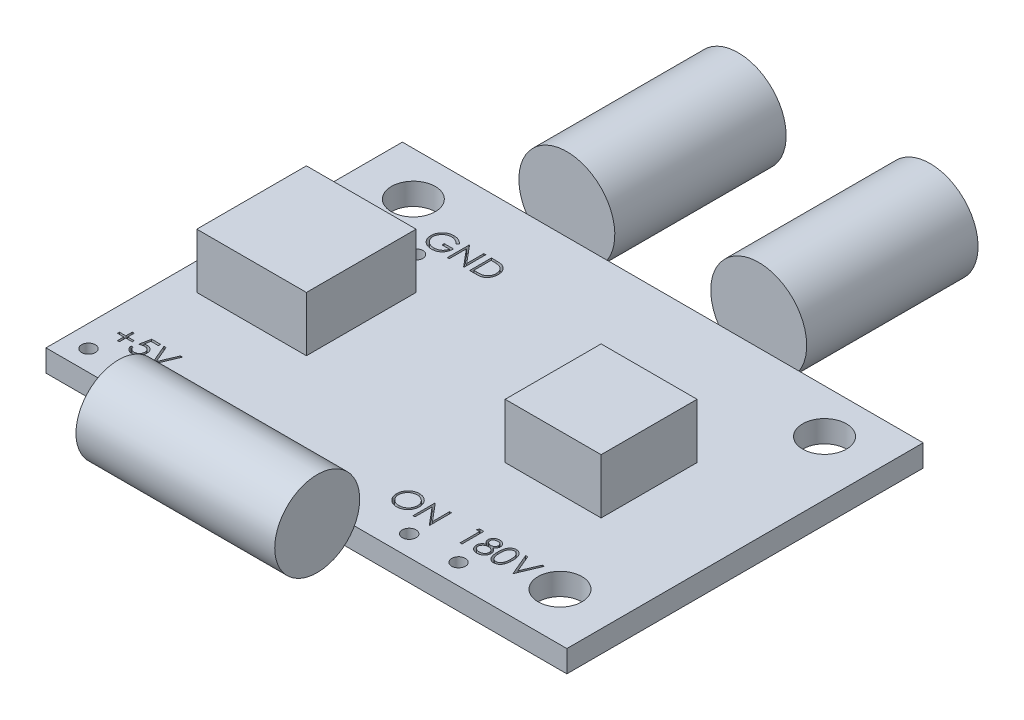
from build123d import *

# Parameters (mm, degrees)
SKETCH1_W           = 38
SKETCH1_H           = 26
SKETCH1_R           = 0.5
SKETCH1_R_2         = 1.6
BOSS_EXTRUDE1_DEPTH = 1.6
SKETCH2_W           = 8
SKETCH2_H           = 8
SKETCH2_W_2         = 7
SKETCH2_H_2         = 7
BOSS_EXTRUDE2_DEPTH = 4
BOSS_EXTRUDE3_START = -8
SKETCH3_R           = 3.1
BOSS_EXTRUDE3_DEPTH = 14.5
SKETCH4_R           = 3.5
BOSS_EXTRUDE4_DEPTH = 12.5
CUT_EXTRUDE1_DEPTH  = 0.5


with BuildPart() as part:
    # Sketch1 → Boss-Extrude1 (new body)
    with BuildSketch(Plane(origin=(0, 0, 0), x_dir=(1, 0, 0), z_dir=(0, 1, 0))):
        with Locations((19, 13)):
            Rectangle(SKETCH1_W, SKETCH1_H)
        with Locations(Location((28.6, 1.5, 0), (0, 0, 270))):
            Circle(SKETCH1_R, mode=Mode.SUBTRACT)
        with Locations(Location((25, 1.5, 0), (0, 0, 270))):
            Circle(SKETCH1_R, mode=Mode.SUBTRACT)
        with Locations(Location((1.6, 1.5, 0), (0, 0, 270))):
            Circle(SKETCH1_R, mode=Mode.SUBTRACT)
        with Locations(Location((7.6, 19.4, 0), (0, 0, 270))):
            Circle(SKETCH1_R, mode=Mode.SUBTRACT)
        with Locations(Location((4, 22.8, 0), (0, 0, 270))):
            Circle(SKETCH1_R_2, mode=Mode.SUBTRACT)
        with Locations(Location((34, 22.8, 0), (0, 0, 270))):
            Circle(SKETCH1_R_2, mode=Mode.SUBTRACT)
        with Locations(Location((34, 3.5, 0), (0, 0, 270))):
            Circle(SKETCH1_R_2, mode=Mode.SUBTRACT)
    extrude(amount=BOSS_EXTRUDE1_DEPTH)

    # Sketch2 → Boss-Extrude2 (add)
    with BuildSketch(Plane(origin=(0, 1.6, 0), x_dir=(1, 0, 0), z_dir=(0, 1, 0))):
        with Locations((6, 13)):
            Rectangle(SKETCH2_W, SKETCH2_H)
        with Locations((27.5, 13)):
            Rectangle(SKETCH2_W_2, SKETCH2_H_2)
    extrude(amount=BOSS_EXTRUDE2_DEPTH)

    # Sketch4 → Boss-Extrude4 (add)
    with BuildSketch(Plane(origin=(0, 0, -26), x_dir=(-1, 0, 0), z_dir=(0, 0, -1))):
        with Locations(Location((-26, 3.5, 0), (0, 0, 212.878349564))):
            Circle(SKETCH4_R)
        with Locations(Location((-12, 3.5, 0), (0, 0, 212.878349564))):
            Circle(SKETCH4_R)
    extrude(amount=BOSS_EXTRUDE4_DEPTH)

    # Sketch5 → Cut-Extrude1 (cut)
    # profile 1 of 12: a face of its own
    with BuildSketch(Plane(origin=(0, 1.6, 0), x_dir=(1, 0, 0), z_dir=(0, 1, 0))):
        with BuildLine():
            add(Edge.make_bspline(
                [(22.823721125, 4.41342604), (22.85311623, 4.412681512), (22.910850642, 4.411219198), (22.99570247, 4.400025461), (23.076708103, 4.380660052), (23.154527416, 4.354868628), (23.228229587, 4.320463246), (23.298369371, 4.278877483), (23.364779881, 4.22967566), (23.426566008, 4.173238118), (23.483106839, 4.111832051), (23.532920723, 4.046300999), (23.574668478, 3.977041185), (23.608952031, 3.904260737), (23.635848186, 3.828124252), (23.654407895, 3.748225829), (23.666263413, 3.665083152), (23.667649427, 3.608374538), (23.668352535, 3.57960693)],
                knots=[0, 0, 0, 0, 1.065120563, 2.091984664, 3.0946048, 4.079830382, 5.057816894, 6.036188127, 7.030412546, 8.04752943, 9.064399622, 10.05169764, 11.02544977, 11.989514704, 12.962713494, 13.945757189, 14.957906945, 16, 16, 16, 16], degree=3))
            add(Edge.make_bspline(
                [(23.668352535, 3.57960693), (23.66764953, 3.551051231), (23.666263825, 3.49476464), (23.654394416, 3.412149578), (23.635779391, 3.332733441), (23.609201798, 3.256648805), (23.575081671, 3.18381541), (23.533055932, 3.114424899), (23.483552597, 3.048454523), (23.427215919, 2.986626993), (23.365801875, 2.929931712), (23.299929575, 2.880529221), (23.231080462, 2.838018636), (23.158368559, 2.804098899), (23.082758185, 2.776988063), (23.003572631, 2.758503835), (22.921182944, 2.746580783), (22.864998596, 2.74521167), (22.836441477, 2.744515784)],
                knots=[0, 0, 0, 0, 1.043624062, 2.057103931, 3.04512605, 4.022047818, 4.998200453, 5.980619268, 6.982898556, 8.009068085, 9.034988726, 10.034168286, 11.015286542, 11.987931943, 12.962482838, 13.94673481, 14.956375938, 16, 16, 16, 16], degree=3))
            add(Edge.make_bspline(
                [(22.836441477, 2.744515784), (22.807674018, 2.745218542), (22.750965699, 2.746603864), (22.667718544, 2.758479001), (22.587763995, 2.777048807), (22.5113307, 2.803587015), (22.438376036, 2.837884831), (22.36875732, 2.879706103), (22.302753992, 2.929330056), (22.240913272, 2.985648467), (22.1843306, 3.046958421), (22.135000454, 3.112651101), (22.093169778, 3.181437683), (22.058987123, 3.25350906), (22.031925029, 3.328516821), (22.013462487, 3.406961309), (22.001517251, 3.488395299), (22.000140732, 3.543841185), (21.999442279, 3.571974718)],
                knots=[0, 0, 0, 0, 1.053102029, 2.075944431, 3.073151272, 4.055350789, 5.033113405, 6.020478099, 7.024410459, 8.052272461, 9.079885166, 10.07527673, 11.055994387, 12.023226415, 12.992069828, 13.970394897, 14.97016774, 16, 16, 16, 16], degree=3))
            add(Edge.make_bspline(
                [(21.999442279, 3.571974718), (21.999684774, 3.590858108), (22.000166706, 3.628386664), (22.005968652, 3.684115443), (22.014387709, 3.738947991), (22.026453577, 3.792728386), (22.042234083, 3.845324975), (22.060854109, 3.8971005), (22.083596111, 3.94753026), (22.109304833, 3.996853156), (22.137998582, 4.044300313), (22.169692225, 4.089149267), (22.203272553, 4.131776362), (22.24008595, 4.171076967), (22.278919123, 4.208194375), (22.32040203, 4.242558179), (22.364281548, 4.274478246), (22.410746485, 4.303243901), (22.458651916, 4.329260366), (22.508035312, 4.351585991), (22.558225971, 4.370747597), (22.609458972, 4.386278257), (22.661598265, 4.398539216), (22.714757646, 4.406888266), (22.768894765, 4.41270501), (22.805367041, 4.413184663), (22.823721125, 4.41342604)],
                knots=[0, 0, 0, 0, 1.037015668, 2.060948919, 3.074880161, 4.083647147, 5.086022904, 6.090072063, 7.104153813, 8.122640571, 9.144368836, 10.147691507, 11.138137339, 12.123020368, 13.103399296, 14.087645067, 15.080126199, 16.082011238, 17.087798457, 18.072939717, 19.057185487, 20.037253025, 21.01195951, 21.997135196, 22.992090687, 24, 24, 24, 24], degree=3))
        make_face()
        with BuildLine():
            add(Edge.make_bspline(
                [(22.830717319, 4.250605528), (22.81565211, 4.250421881), (22.785665717, 4.250056343), (22.741086659, 4.245241358), (22.697093889, 4.238378873), (22.653678321, 4.228590112), (22.611021612, 4.215253273), (22.568726148, 4.199904004), (22.52717762, 4.181207295), (22.486513191, 4.160083247), (22.447090997, 4.13670213), (22.409892378, 4.110861364), (22.374821036, 4.083166948), (22.34196284, 4.053554251), (22.311414273, 4.021872467), (22.282574069, 3.988601898), (22.256598223, 3.952791576), (22.232792265, 3.91541257), (22.211488995, 3.876513567), (22.192545423, 3.836504093), (22.177049605, 3.795057786), (22.164412027, 3.752624293), (22.153934613, 3.70927082), (22.147297083, 3.664668488), (22.142429191, 3.61904142), (22.142084547, 3.588206793), (22.141910227, 3.572610736)],
                knots=[0, 0, 0, 0, 1.008559885, 2.007477868, 2.99961109, 3.989939068, 4.984837346, 5.991145699, 7.001802488, 8.033829008, 9.059044045, 10.069351652, 11.065060232, 12.050310815, 13.029377138, 14.011219647, 14.996725999, 15.989392538, 16.977580475, 17.965360261, 18.951710183, 19.937753436, 20.929683414, 21.935841486, 22.955955122, 24, 24, 24, 24], degree=3))
            add(Edge.make_bspline(
                [(22.141910227, 3.572610736), (22.142488468, 3.549677157), (22.143626047, 3.504559713), (22.153585374, 3.438443448), (22.168926055, 3.374903404), (22.191539932, 3.314287252), (22.219820389, 3.256073952), (22.254757586, 3.200779919), (22.2961501, 3.148390208), (22.343168913, 3.099270568), (22.394568855, 3.054436936), (22.449148344, 3.015083533), (22.506322658, 2.981786741), (22.566240897, 2.954660869), (22.628583173, 2.933166238), (22.693751205, 2.918434858), (22.761310878, 2.908739563), (22.807362282, 2.907808491), (22.830717319, 2.907336297)],
                knots=[0, 0, 0, 0, 1.032063989, 2.030389145, 3.003944642, 3.970395727, 4.937377036, 5.913328081, 6.909231446, 7.93887556, 8.970685674, 9.976071282, 10.964166581, 11.944589148, 12.933237628, 13.927779006, 14.949070134, 16, 16, 16, 16], degree=3))
            add(Edge.make_bspline(
                [(22.830717319, 2.907336297), (22.8464152, 2.907551972), (22.877548813, 2.907979721), (22.923856425, 2.912288049), (22.969329778, 2.91919679), (23.01390509, 2.929143909), (23.057531773, 2.941593177), (23.100391916, 2.956383111), (23.142028997, 2.974834943), (23.182968281, 2.995222049), (23.222155148, 3.018463121), (23.259563693, 3.043426853), (23.294251012, 3.071080477), (23.327084627, 3.1002532), (23.357758614, 3.131533231), (23.386065546, 3.164879903), (23.411910106, 3.200503701), (23.435707024, 3.23782601), (23.456935647, 3.276831453), (23.475431881, 3.316985985), (23.491123691, 3.358190731), (23.503791263, 3.400505123), (23.513717883, 3.443848793), (23.520557704, 3.488279779), (23.525342174, 3.533709195), (23.525702798, 3.564435873), (23.525884586, 3.579924939)],
                knots=[0, 0, 0, 0, 1.047197238, 2.076906641, 3.100256066, 4.114471768, 5.12198147, 6.126382909, 7.136867548, 8.15857795, 9.17633901, 10.174870724, 11.156907918, 12.133735059, 13.104061851, 14.077631395, 15.04955518, 16.038496417, 17.029181396, 18.010275684, 18.986308667, 19.968651475, 20.955262928, 21.950658345, 22.966943676, 24, 24, 24, 24], degree=3))
            add(Edge.make_bspline(
                [(23.525884586, 3.579924939), (23.525702653, 3.595308042), (23.525341754, 3.625823262), (23.520559989, 3.670935848), (23.513710657, 3.715047126), (23.503839714, 3.757983922), (23.491116966, 3.799757182), (23.475429141, 3.840327671), (23.456930094, 3.879846531), (23.435699221, 3.918216087), (23.411834187, 3.955034629), (23.385756441, 3.990232866), (23.35701573, 4.023149788), (23.326433211, 4.054598024), (23.293244988, 4.083906853), (23.257601398, 4.111085996), (23.219935158, 4.136791374), (23.180053876, 4.159980468), (23.138895012, 4.181395495), (23.096661181, 4.199742914), (23.053830839, 4.215333126), (23.010512902, 4.228630463), (22.966342766, 4.238340534), (22.921618886, 4.245247542), (22.87640314, 4.250054668), (22.845994251, 4.250421325), (22.830717319, 4.250605528)],
                knots=[0, 0, 0, 0, 1.02996197, 2.043119294, 3.035359645, 4.018872909, 4.991431989, 5.957985074, 6.929999688, 7.912076566, 8.892894881, 9.867085534, 10.843653904, 11.817741046, 12.803660682, 13.806313499, 14.818574707, 15.856120519, 16.894564902, 17.924820532, 18.937903209, 19.946497019, 20.957711757, 21.963978472, 22.977135795, 24, 24, 24, 24], degree=3))
        make_face(mode=Mode.SUBTRACT)
    # profile 2 of 12: a face of its own
    with BuildSketch(Plane(origin=(0, 1.6, 0), x_dir=(1, 0, 0), z_dir=(0, 1, 0))):
        Polygon((23.993993561, 2.785220912), (23.993993561, 4.372720912), (24.023886389, 4.372720912), (25.072679458, 3.123264282), (25.072679458, 4.372720912), (25.215147407, 4.372720912), (25.215147407, 2.785220912), (25.182710508, 2.785220912), (24.136461509, 4.031815464), (24.136461509, 2.785220912), align=None)
    # profile 3 of 12: a face of its own
    with BuildSketch(Plane(origin=(0, 1.6, 0), x_dir=(1, 0, 0), z_dir=(0, 1, 0))):
        Polygon((27.274784117, 4.372720912), (27.568306253, 4.372720912), (27.568306253, 2.785220912), (27.425838304, 2.785220912), (27.425838304, 4.209900399), (27.181607535, 4.209900399), align=None)
    # profile 4 of 12: a face of its own
    with BuildSketch(Plane(origin=(0, 1.6, 0), x_dir=(1, 0, 0), z_dir=(0, 1, 0))):
        with BuildLine():
            add(Edge.make_bspline(
                [(28.930338004, 3.669603424), (28.943332166, 3.662827994), (28.968675122, 3.649613643), (29.00476907, 3.628336232), (29.037755053, 3.605911223), (29.068548272, 3.583397815), (29.096607721, 3.559933816), (29.121619651, 3.53542592), (29.144201893, 3.510485866), (29.163899041, 3.484691332), (29.181224035, 3.458110845), (29.196197396, 3.430674639), (29.208995913, 3.402442841), (29.219139103, 3.373107279), (29.227494702, 3.343098874), (29.233243994, 3.312030147), (29.236335953, 3.280105821), (29.236920522, 3.258530198), (29.237216509, 3.247605728)],
                knots=[0, 0, 0, 0, 1.272397273, 2.481599622, 3.635517121, 4.734568067, 5.792894095, 6.808321871, 7.773003508, 8.711915296, 9.623354172, 10.525449501, 11.423591555, 12.311487226, 13.218079475, 14.126165749, 15.051214107, 16, 16, 16, 16], degree=3))
            add(Edge.make_bspline(
                [(29.237216509, 3.247605728), (29.236866615, 3.232321399), (29.236174043, 3.202067978), (29.23014155, 3.157415634), (29.221109592, 3.114048862), (29.207919956, 3.071977168), (29.190814239, 3.031432702), (29.169733674, 2.992380758), (29.145870735, 2.954181286), (29.126706327, 2.930677486), (29.117009177, 2.918784614)],
                knots=[0, 0, 0, 0, 1.025265484, 2.029385089, 3.018602448, 3.995076438, 4.983346944, 5.966715145, 6.97116228, 8, 8, 8, 8], degree=3))
            add(Edge.make_bspline(
                [(29.117009177, 2.918784614), (29.104383348, 2.904908152), (29.07928771, 2.877326704), (29.036296882, 2.841516872), (28.989115528, 2.811422683), (28.937926213, 2.786897216), (28.88286577, 2.767808273), (28.823945932, 2.754091131), (28.761051834, 2.746234172), (28.717823996, 2.745098434), (28.695647499, 2.744515784)],
                knots=[0, 0, 0, 0, 0.954267603, 1.896743057, 2.838368354, 3.796610408, 4.779680527, 5.799409237, 6.871065594, 8, 8, 8, 8], degree=3))
            add(Edge.make_bspline(
                [(28.695647499, 2.744515784), (28.674323569, 2.745038515), (28.632829367, 2.746055697), (28.572432759, 2.752947457), (28.516134081, 2.765025096), (28.463605988, 2.78155533), (28.415165152, 2.803059255), (28.370949602, 2.829823783), (28.330321408, 2.860771616), (28.294513543, 2.896791573), (28.262723427, 2.935371393), (28.234797918, 2.975173016), (28.211586818, 3.016200075), (28.191934885, 3.05784082), (28.176890818, 3.100678897), (28.16647128, 3.144493903), (28.159853984, 3.189209307), (28.15897354, 3.219386164), (28.158530612, 3.234567367)],
                knots=[0, 0, 0, 0, 1.256902934, 2.445805442, 3.576955095, 4.645999104, 5.686449165, 6.692658513, 7.68621702, 8.689161843, 9.678783111, 10.630372946, 11.551080876, 12.453998257, 13.34127905, 14.221779781, 15.105423033, 16, 16, 16, 16], degree=3))
            add(Edge.make_bspline(
                [(28.158530612, 3.234567367), (28.158792722, 3.245706714), (28.159310745, 3.267721997), (28.162896158, 3.3002473), (28.168660353, 3.331904832), (28.176488749, 3.362811527), (28.187098251, 3.392742376), (28.199908075, 3.421839198), (28.214845068, 3.450134842), (28.232117596, 3.477784049), (28.252211729, 3.504399399), (28.274964527, 3.530432583), (28.300830739, 3.555479644), (28.329522606, 3.579846601), (28.360712236, 3.603965703), (28.395209759, 3.62653348), (28.432100659, 3.649147628), (28.458319539, 3.662667833), (28.471769294, 3.669603424)],
                knots=[0, 0, 0, 0, 0.941657376, 1.861047343, 2.762797495, 3.66048619, 4.553285746, 5.444104102, 6.34607688, 7.256116206, 8.197091036, 9.162375105, 10.176350973, 11.237807142, 12.343728897, 13.50695164, 14.721116704, 16, 16, 16, 16], degree=3))
            add(Edge.make_bspline(
                [(28.471769294, 3.669603424), (28.453358206, 3.679643123), (28.417709187, 3.69908279), (28.370506262, 3.734800091), (28.329961229, 3.773484207), (28.297188553, 3.815952007), (28.271392936, 3.860876839), (28.253695211, 3.907977625), (28.24172252, 3.956381005), (28.240536509, 3.989449173), (28.239940868, 4.00605675)],
                knots=[0, 0, 0, 0, 1.166880483, 2.259407225, 3.286803203, 4.280235371, 5.237608625, 6.161067461, 7.076446754, 8, 8, 8, 8], degree=3))
            add(Edge.make_bspline(
                [(28.239940868, 4.00605675), (28.24068265, 4.022973856), (28.24217376, 4.056980191), (28.254231195, 4.10760154), (28.273879939, 4.157320482), (28.30060482, 4.205896038), (28.333891165, 4.251684171), (28.373826562, 4.292750957), (28.419457343, 4.32872438), (28.470555733, 4.358921429), (28.525545026, 4.383497589), (28.583563943, 4.400451374), (28.643601603, 4.411534898), (28.684467354, 4.412789773), (28.705187763, 4.41342604)],
                knots=[0, 0, 0, 0, 0.888701115, 1.786444228, 2.72001202, 3.692817113, 4.693886446, 5.687152267, 6.695133018, 7.739871481, 8.800368666, 9.853104506, 10.91144658, 12, 12, 12, 12], degree=3))
            add(Edge.make_bspline(
                [(28.705187763, 4.41342604), (28.725373422, 4.412770021), (28.765177242, 4.411476424), (28.823685519, 4.400687376), (28.879667517, 4.382667201), (28.932930183, 4.35822096), (28.982519994, 4.328109741), (29.026336042, 4.291642201), (29.065040463, 4.250756569), (29.097055527, 4.204982321), (29.123436552, 4.156593419), (29.141806604, 4.105964632), (29.153577678, 4.054189881), (29.155062382, 4.019156929), (29.155806253, 4.001604626)],
                knots=[0, 0, 0, 0, 1.072916533, 2.115669174, 3.151510826, 4.193348718, 5.225979165, 6.227137561, 7.216255879, 8.211077061, 9.189680878, 10.138522389, 11.067357538, 12, 12, 12, 12], degree=3))
            add(Edge.make_bspline(
                [(29.155806253, 4.001604626), (29.155155577, 3.984379497), (29.153877687, 3.950550321), (29.143128072, 3.901235078), (29.125024533, 3.85505151), (29.100307537, 3.811475564), (29.068092406, 3.771297527), (29.028809159, 3.734006486), (28.982770988, 3.699296103), (28.948181229, 3.679708002), (28.930338004, 3.669603424)],
                knots=[0, 0, 0, 0, 0.975232327, 1.915300861, 2.843280834, 3.77672583, 4.742871857, 5.749627742, 6.839139064, 8, 8, 8, 8], degree=3))
        make_face()
        with BuildLine():
            add(Edge.make_bspline(
                [(28.697237543, 4.250605528), (28.686101999, 4.250310053), (28.664316005, 4.249731975), (28.632371572, 4.246711807), (28.60199482, 4.240836598), (28.572868368, 4.233017611), (28.545391549, 4.222454845), (28.519191198, 4.210029252), (28.494713222, 4.194922572), (28.471662131, 4.1779766), (28.450910887, 4.159338032), (28.432493823, 4.139918952), (28.417195714, 4.119337971), (28.404204925, 4.098107036), (28.394779022, 4.075596025), (28.387719499, 4.052495099), (28.382947296, 4.028512335), (28.382589705, 4.012121846), (28.382408817, 4.003830688)],
                knots=[0, 0, 0, 0, 1.203892937, 2.355340988, 3.463153438, 4.544400666, 5.610487187, 6.640501085, 7.674077295, 8.714426146, 9.728707835, 10.68524104, 11.601827946, 12.495867327, 13.368432065, 14.231010473, 15.105153427, 16, 16, 16, 16], degree=3))
            add(Edge.make_bspline(
                [(28.382408817, 4.003830688), (28.382720587, 3.995539171), (28.383336689, 3.979153943), (28.388101515, 3.954957782), (28.395203017, 3.931180825), (28.406383853, 3.908388448), (28.419794308, 3.885789996), (28.436345799, 3.863950266), (28.45607118, 3.842793252), (28.478308626, 3.822498905), (28.502534573, 3.803494823), (28.528199479, 3.786996987), (28.554981235, 3.773192945), (28.582604673, 3.76170425), (28.611351326, 3.752773457), (28.641045048, 3.746437678), (28.671690829, 3.742499773), (28.692455593, 3.742029409), (28.702961701, 3.741791425)],
                knots=[0, 0, 0, 0, 0.873023192, 1.725219244, 2.590779336, 3.480155217, 4.391973325, 5.357036234, 6.360879153, 7.436073238, 8.526419356, 9.601555421, 10.645666583, 11.697338044, 12.750135903, 13.812665442, 14.89329948, 16, 16, 16, 16], degree=3))
            add(Edge.make_bspline(
                [(28.702961701, 3.741791425), (28.716455499, 3.742187333), (28.743309815, 3.742975238), (28.782897226, 3.750300949), (28.821388497, 3.761824347), (28.858372215, 3.777590474), (28.89289108, 3.797378825), (28.923661397, 3.82107023), (28.950420702, 3.848117645), (28.972890907, 3.878100003), (28.990312516, 3.910009473), (29.003875122, 3.942031749), (29.01179503, 3.974508475), (29.012828069, 3.99626492), (29.013338304, 4.007010776)],
                knots=[0, 0, 0, 0, 1.076279235, 2.141928126, 3.20205304, 4.278698113, 5.344010996, 6.36967002, 7.368914609, 8.37248503, 9.349703398, 10.264243087, 11.142681841, 12, 12, 12, 12], degree=3))
            add(Edge.make_bspline(
                [(29.013338304, 4.007010776), (29.013097051, 4.014552778), (29.012618197, 4.029522571), (29.0086721, 4.051628901), (29.002151633, 4.073232319), (28.993323736, 4.094511292), (28.981707865, 4.115167267), (28.967935537, 4.135524953), (28.951205781, 4.155126389), (28.932429541, 4.17442837), (28.911136445, 4.192291838), (28.887367528, 4.208001153), (28.861244648, 4.221341757), (28.832767189, 4.232177014), (28.802040027, 4.240315151), (28.769204687, 4.246409495), (28.733987385, 4.249844442), (28.709753176, 4.25034633), (28.697237543, 4.250605528)],
                knots=[0, 0, 0, 0, 0.814439003, 1.616544685, 2.417341072, 3.248991801, 4.09997495, 4.973547432, 5.9003056, 6.880240646, 7.880314356, 8.896779544, 9.951930927, 11.043077905, 12.18215768, 13.381699519, 14.647792085, 16, 16, 16, 16], degree=3))
        make_face(mode=Mode.SUBTRACT)
        with BuildLine():
            add(Edge.make_bspline(
                [(28.706459798, 3.578970912), (28.692342031, 3.578719796), (28.664646417, 3.578227168), (28.624071311, 3.572743716), (28.585130768, 3.565110384), (28.547956082, 3.553530326), (28.512562953, 3.538473346), (28.478759779, 3.52036018), (28.446805159, 3.498949139), (28.417140351, 3.474512246), (28.390051555, 3.448178136), (28.366285184, 3.420300668), (28.34610238, 3.391397948), (28.329849441, 3.361102901), (28.31650912, 3.33005702), (28.307748897, 3.297487147), (28.302132906, 3.26401942), (28.301378784, 3.241268233), (28.30099856, 3.229797234)],
                knots=[0, 0, 0, 0, 1.140299081, 2.23698856, 3.303958914, 4.344563908, 5.37730929, 6.408454204, 7.439741482, 8.480804886, 9.510774543, 10.48932336, 11.43758569, 12.353841022, 13.263987381, 14.161954604, 15.073269652, 16, 16, 16, 16], degree=3))
            add(Edge.make_bspline(
                [(28.30099856, 3.229797234), (28.301616896, 3.215541073), (28.302843658, 3.187257183), (28.312575777, 3.145454647), (28.328194752, 3.104986526), (28.349977618, 3.066182604), (28.376950409, 3.029919521), (28.410118486, 2.998310683), (28.44742058, 2.97022487), (28.490118821, 2.94750977), (28.536758875, 2.929369247), (28.587328338, 2.91687065), (28.641101462, 2.908596849), (28.678230634, 2.907763103), (28.697237543, 2.907336297)],
                knots=[0, 0, 0, 0, 0.898778495, 1.783155532, 2.693654817, 3.627872908, 4.583023416, 5.533784346, 6.509005473, 7.520592997, 8.575161974, 9.658835044, 10.801527049, 12, 12, 12, 12], degree=3))
            add(Edge.make_bspline(
                [(28.697237543, 2.907336297), (28.712092174, 2.907621506), (28.741033759, 2.908177186), (28.783254886, 2.913082241), (28.823098663, 2.920860821), (28.860487825, 2.9321745), (28.895840924, 2.94598574), (28.928558553, 2.963753077), (28.959482385, 2.983960738), (28.987088612, 3.007935687), (29.012231531, 3.033553172), (29.034154132, 3.060672228), (29.053184878, 3.088555818), (29.068121419, 3.117834073), (29.080062255, 3.147945281), (29.088645439, 3.179167102), (29.093941437, 3.211595297), (29.094477057, 3.23359309), (29.09474856, 3.244743649)],
                knots=[0, 0, 0, 0, 1.224942928, 2.386581632, 3.501229538, 4.569074225, 5.605009692, 6.626002462, 7.634866581, 8.645888296, 9.63523824, 10.59253846, 11.518950513, 12.414518923, 13.29783783, 14.186679152, 15.080837789, 16, 16, 16, 16], degree=3))
            add(Edge.make_bspline(
                [(29.09474856, 3.244743649), (29.094337693, 3.255573728), (29.093527535, 3.276928753), (29.088385536, 3.308572856), (29.079352263, 3.339144847), (29.066957337, 3.369012528), (29.050455972, 3.397570724), (29.031022763, 3.425563416), (29.007575788, 3.45221366), (28.981081503, 3.477728457), (28.952207617, 3.501321309), (28.921515734, 3.522192144), (28.889242103, 3.539768997), (28.855455018, 3.554063979), (28.820229501, 3.565306867), (28.783591462, 3.573160907), (28.745498005, 3.578104656), (28.719619546, 3.578678898), (28.706459798, 3.578970912)],
                knots=[0, 0, 0, 0, 0.917430815, 1.809013306, 2.70690318, 3.612392954, 4.541220862, 5.495268465, 6.494511384, 7.542276156, 8.608045339, 9.649016899, 10.681629292, 11.715607085, 12.752076957, 13.808767841, 14.885711793, 16, 16, 16, 16], degree=3))
        make_face(mode=Mode.SUBTRACT)
    # profile 5 of 12: a face of its own
    with BuildSketch(Plane(origin=(0, 1.6, 0), x_dir=(1, 0, 0), z_dir=(0, 1, 0))):
        with BuildLine():
            add(Edge.make_bspline(
                [(29.379684458, 3.578334895), (29.379833238, 3.603779067), (29.380122244, 3.653204738), (29.383337349, 3.725224915), (29.388678308, 3.792789046), (29.39599776, 3.855900366), (29.404904986, 3.914575166), (29.416795582, 3.968656645), (29.430317817, 4.01839511), (29.44598982, 4.063952753), (29.463673567, 4.105943354), (29.482920535, 4.145143356), (29.504494567, 4.181493447), (29.527162667, 4.215573802), (29.551842428, 4.246826549), (29.577831522, 4.275693042), (29.606144302, 4.301506133), (29.635818309, 4.325022134), (29.667122205, 4.345636716), (29.6991637, 4.363794422), (29.732163337, 4.379306505), (29.766211213, 4.391503238), (29.801001302, 4.401577444), (29.836655222, 4.408466717), (29.87323184, 4.412801457), (29.897920384, 4.413215871), (29.910441169, 4.41342604)],
                knots=[0, 0, 0, 0, 1.646270934, 3.197905019, 4.663502075, 6.030701355, 7.308322542, 8.50163776, 9.611534131, 10.641858119, 11.616356847, 12.558055219, 13.465016945, 14.349605745, 15.204443733, 16.039544428, 16.859896111, 17.680448484, 18.487036065, 19.28249412, 20.06191084, 20.843045899, 21.620316918, 22.403196591, 23.190181807, 24, 24, 24, 24], degree=3))
            add(Edge.make_bspline(
                [(29.910441169, 4.41342604), (29.923066546, 4.413204781), (29.94817445, 4.412764767), (29.985294906, 4.408535693), (30.021557798, 4.401518434), (30.056808525, 4.391575706), (30.091336644, 4.379240524), (30.124872086, 4.363779581), (30.157623155, 4.345782381), (30.189069393, 4.324635122), (30.219556022, 4.301057447), (30.248334205, 4.274404379), (30.275406562, 4.244945042), (30.301112861, 4.212994626), (30.324723792, 4.177940319), (30.347208885, 4.140391812), (30.367334773, 4.099692456), (30.386718, 4.056521315), (30.403448884, 4.00968387), (30.418537502, 3.959444139), (30.430729034, 3.905208704), (30.440884168, 3.847262122), (30.448751318, 3.785391585), (30.454481123, 3.71972972), (30.457507844, 3.650233329), (30.458077848, 3.602718161), (30.458370355, 3.578334895)],
                knots=[0, 0, 0, 0, 0.810914788, 1.612654377, 2.396697861, 3.181598691, 3.963628158, 4.749916497, 5.551656086, 6.361998678, 7.18212741, 8.025565596, 8.878627764, 9.750805457, 10.657531673, 11.591944965, 12.560506719, 13.57287815, 14.630710178, 15.753379473, 16.941251878, 18.199788006, 19.531962791, 20.947069417, 22.433333509, 24, 24, 24, 24], degree=3))
            add(Edge.make_bspline(
                [(30.458370355, 3.578334895), (30.458074815, 3.554057979), (30.457498967, 3.5067554), (30.454515054, 3.437571707), (30.448637389, 3.372258309), (30.441285001, 3.310658564), (30.431101886, 3.253028858), (30.418580971, 3.199169769), (30.404678861, 3.148848708), (30.387518079, 3.102477918), (30.368735364, 3.05941053), (30.348299614, 3.019193644), (30.3264058, 2.98147179), (30.302553048, 2.946546905), (30.277128821, 2.914171586), (30.249588967, 2.884917307), (30.220709809, 2.858079181), (30.190133463, 2.834197907), (30.158196795, 2.813295156), (30.125558214, 2.794601731), (30.091638608, 2.77952833), (30.057206662, 2.766585651), (30.021769867, 2.756697589), (29.985372397, 2.749860518), (29.94819939, 2.74506543), (29.923070823, 2.744699634), (29.910441169, 2.744515784)],
                knots=[0, 0, 0, 0, 1.561518951, 3.042555995, 4.452378317, 5.7783523, 7.031515105, 8.214008947, 9.334062868, 10.386615937, 11.391082383, 12.354592575, 13.286541444, 14.194233754, 15.072674879, 15.931287219, 16.775624067, 17.606195743, 18.42308326, 19.229000347, 20.022332153, 20.807536673, 21.593273796, 22.3848459, 23.188221202, 24, 24, 24, 24], degree=3))
            add(Edge.make_bspline(
                [(29.910441169, 2.744515784), (29.897920731, 2.74472731), (29.873232872, 2.745144397), (29.836651237, 2.749459553), (29.801144557, 2.756397157), (29.766537622, 2.766111116), (29.732652881, 2.778001417), (29.699952066, 2.793492552), (29.66807158, 2.811333362), (29.637096482, 2.831651285), (29.607608823, 2.854929334), (29.57944267, 2.880675994), (29.553305608, 2.909533756), (29.528978714, 2.941046956), (29.505858324, 2.974925677), (29.484590644, 3.011632475), (29.464918864, 3.051021802), (29.446937709, 3.09334814), (29.43099528, 3.139229125), (29.416912927, 3.189189645), (29.405794005, 3.243670666), (29.396276736, 3.302234614), (29.38860032, 3.365133147), (29.383359608, 3.432400411), (29.380120511, 3.503994488), (29.379832461, 3.553102564), (29.379684458, 3.578334895)],
                knots=[0, 0, 0, 0, 0.810891512, 1.598919785, 2.382837074, 3.152667961, 3.926044502, 4.706494248, 5.493654104, 6.291793342, 7.103789334, 7.925228297, 8.761435821, 9.622817696, 10.50288917, 11.416980706, 12.369136599, 13.353924996, 14.394355917, 15.514179734, 16.714354668, 17.994756427, 19.357759367, 20.818452758, 22.365282078, 24, 24, 24, 24], degree=3))
        make_face()
        with BuildLine():
            add(Edge.make_bspline(
                [(29.522152407, 3.578970912), (29.522206584, 3.557767038), (29.522311733, 3.516614482), (29.525058652, 3.456814146), (29.528800722, 3.401038318), (29.53362731, 3.349216178), (29.540795076, 3.301523137), (29.548826369, 3.257631174), (29.558599967, 3.21777257), (29.570163779, 3.181673813), (29.583335083, 3.148722271), (29.597715957, 3.118060291), (29.613164928, 3.089325663), (29.630454686, 3.062776491), (29.649284732, 3.038326195), (29.669229746, 3.015542017), (29.691034097, 2.995223386), (29.721198294, 2.97085442), (29.761020267, 2.945672527), (29.811194545, 2.923744122), (29.862751306, 2.909963508), (29.897744909, 2.908211019), (29.915211301, 2.907336297)],
                knots=[0, 0, 0, 0, 1.459021318, 2.831673884, 4.118529203, 5.306027144, 6.411944654, 7.436330062, 8.375795394, 9.233974572, 10.042671642, 10.816086306, 11.563610507, 12.285937304, 12.993564865, 13.685989202, 14.367179055, 15.041617293, 16.353048772, 17.594441528, 18.799311195, 20, 20, 20, 20], degree=3))
            add(Edge.make_bspline(
                [(29.915211301, 2.907336297), (29.932790673, 2.908061005), (29.967913124, 2.909508924), (30.019227381, 2.923478351), (30.069043253, 2.944555607), (30.108083026, 2.969478225), (30.137784037, 2.99321286), (30.159064243, 3.01344879), (30.178595958, 3.036107344), (30.197120756, 3.060554525), (30.214111123, 3.087257401), (30.229561189, 3.11608757), (30.243659707, 3.14712509), (30.251692024, 3.168792078), (30.255798741, 3.179869851)],
                knots=[0, 0, 0, 0, 1.353760809, 2.704726607, 4.075137775, 5.516104923, 6.260822281, 7.007110065, 7.778089737, 8.566572457, 9.372053459, 10.217411131, 11.088608312, 12, 12, 12, 12], degree=3))
            add(Edge.make_bspline(
                [(30.255798741, 3.179869851), (30.260584721, 3.194034768), (30.270302314, 3.222795625), (30.282826226, 3.267410568), (30.292689318, 3.314220393), (30.301562701, 3.362945356), (30.307619266, 3.413944792), (30.312494167, 3.467060902), (30.315365586, 3.522333734), (30.315721526, 3.559887177), (30.315902407, 3.578970912)],
                knots=[0, 0, 0, 0, 0.884706709, 1.796334032, 2.740027952, 3.714592787, 4.726048262, 5.777819803, 6.87074269, 8, 8, 8, 8], degree=3))
            add(Edge.make_bspline(
                [(30.315902407, 3.578970912), (30.315652856, 3.598051561), (30.315164683, 3.63537739), (30.313298696, 3.690040993), (30.308480146, 3.741960299), (30.303128403, 3.791358977), (30.29523752, 3.837963579), (30.286729515, 3.882164253), (30.275298965, 3.923413411), (30.263088924, 3.962356864), (30.249114209, 3.998552161), (30.233731001, 4.032168057), (30.217301846, 4.063366843), (30.19945733, 4.09206292), (30.180409288, 4.118384823), (30.159654971, 4.1418048), (30.138017631, 4.163048711), (30.107711264, 4.187297804), (30.068035426, 4.212022752), (30.01866615, 4.234776507), (29.967289822, 4.247843126), (29.932558291, 4.249685391), (29.915211301, 4.250605528)],
                knots=[0, 0, 0, 0, 1.31362396, 2.569729283, 3.763502607, 4.902122613, 5.988968491, 7.01645872, 7.998833611, 8.933434873, 9.825090667, 10.667526885, 11.477055099, 12.250526234, 12.991942729, 13.710640831, 14.402115721, 15.076753259, 16.378508321, 17.609869233, 18.806226677, 20, 20, 20, 20], degree=3))
            add(Edge.make_bspline(
                [(29.915211301, 4.250605528), (29.897653282, 4.249684122), (29.862505259, 4.247839631), (29.810594936, 4.234825191), (29.760836177, 4.212140738), (29.721265256, 4.187215912), (29.690937753, 4.163476749), (29.669582389, 4.142890751), (29.649558946, 4.120372628), (29.631113239, 4.095697474), (29.613837029, 4.069179254), (29.597970641, 4.04060935), (29.583675281, 4.009842981), (29.570483366, 3.976906241), (29.55888428, 3.940810598), (29.549316661, 3.90100109), (29.54047789, 3.857248732), (29.534220751, 3.809297384), (29.528658261, 3.757462264), (29.525083507, 3.701547195), (29.522302544, 3.641646565), (29.522203455, 3.600281233), (29.522152407, 3.578970912)],
                knots=[0, 0, 0, 0, 1.207732386, 2.417664972, 3.655092373, 4.956220595, 5.625982001, 6.301752483, 6.994047911, 7.697131622, 8.419323945, 9.170223765, 9.943494443, 10.752040957, 11.610060368, 12.549350801, 13.567764191, 14.679664412, 15.874934091, 17.154273443, 18.533957287, 20, 20, 20, 20], degree=3))
        make_face(mode=Mode.SUBTRACT)
    # profile 6 of 12: a face of its own
    with BuildSketch(Plane(origin=(0, 1.6, 0), x_dir=(1, 0, 0), z_dir=(0, 1, 0))):
        Polygon((30.621190868, 4.372720912), (30.773835099, 4.372720912), (31.303001766, 3.121674238), (31.832168432, 4.372720912), (31.984812663, 4.372720912), (31.313178048, 2.785220912), (31.292825484, 2.785220912), align=None)
    # profile 7 of 12: a face of its own
    with BuildSketch(Plane(origin=(0, 1.6, 0), x_dir=(1, 0, 0), z_dir=(0, 1, 0))):
        with BuildLine():
            Line((8.51148536, 21.656377846), (8.389369976, 21.540622638))
            add(Edge.make_bspline(
                [(8.389369976, 21.540622638), (8.36727248, 21.561410208), (8.323604416, 21.602489657), (8.252411735, 21.655789287), (8.178133229, 21.701448553), (8.10115649, 21.738598882), (8.023387788, 21.768241027), (7.945859379, 21.789344862), (7.869366507, 21.802803477), (7.818490662, 21.804412916), (7.793421458, 21.805205971)],
                knots=[0, 0, 0, 0, 1.08915593, 2.152340314, 3.188132944, 4.216796309, 5.218260357, 6.173443236, 7.099959455, 8, 8, 8, 8], degree=3))
            add(Edge.make_bspline(
                [(7.793421458, 21.805205971), (7.778038719, 21.805018372), (7.747313137, 21.804643659), (7.701673898, 21.799861104), (7.656513317, 21.792982755), (7.611916643, 21.783030546), (7.567797167, 21.770417151), (7.524308333, 21.754639459), (7.481369019, 21.736244759), (7.439383689, 21.71498928), (7.398679961, 21.691639492), (7.360236682, 21.665763904), (7.323808819, 21.638191846), (7.290081054, 21.608233009), (7.258859381, 21.576158766), (7.229400655, 21.542565767), (7.202740953, 21.506536221), (7.178660317, 21.468733026), (7.15717844, 21.429820141), (7.138215229, 21.390172106), (7.122296193, 21.349920429), (7.109700762, 21.309014601), (7.099309144, 21.267771083), (7.091998657, 21.2259043), (7.08787718, 21.183369421), (7.087164265, 21.154886379), (7.086805873, 21.14056755)],
                knots=[0, 0, 0, 0, 1.02818874, 2.053710826, 3.065248034, 4.081641283, 5.106893873, 6.131558223, 7.173050175, 8.228653731, 9.27666206, 10.308777013, 11.325269123, 12.329503258, 13.32196095, 14.316845687, 15.314881793, 16.315733098, 17.311955233, 18.285320748, 19.252783886, 20.203351036, 21.145449891, 22.095197417, 23.042428769, 24, 24, 24, 24], degree=3))
            add(Edge.make_bspline(
                [(7.086805873, 21.14056755), (7.087148645, 21.125930429), (7.087833254, 21.096696157), (7.092214899, 21.053065274), (7.100346636, 21.010082395), (7.111217704, 20.967606278), (7.124816146, 20.925564176), (7.141767319, 20.884138359), (7.161844931, 20.84333036), (7.185084367, 20.80350787), (7.210568824, 20.76471707), (7.239118007, 20.728177572), (7.269444057, 20.693402806), (7.30265179, 20.66116487), (7.337676368, 20.63060146), (7.375564222, 20.602554634), (7.415570338, 20.576484154), (7.457755752, 20.55271859), (7.501662728, 20.531487575), (7.546682756, 20.512608165), (7.592959658, 20.497060037), (7.640250235, 20.484388112), (7.688498112, 20.474001191), (7.737948194, 20.467318959), (7.788236886, 20.462469903), (7.822136194, 20.46211536), (7.839214727, 20.461936741)],
                knots=[0, 0, 0, 0, 0.93586088, 1.869166235, 2.799637598, 3.729985548, 4.670839027, 5.622275134, 6.589130586, 7.576015415, 8.568469353, 9.55398029, 10.53834874, 11.515998671, 12.510579167, 13.508179873, 14.527009472, 15.561807829, 16.601455013, 17.643573243, 18.680854198, 19.719860599, 20.772568776, 21.833555941, 22.908541556, 24, 24, 24, 24], degree=3))
            add(Edge.make_bspline(
                [(7.839214727, 20.461936741), (7.859797049, 20.462366988), (7.900213782, 20.463211848), (7.95962549, 20.469788765), (8.016686168, 20.480060703), (8.071235482, 20.495103807), (8.123336788, 20.514291545), (8.173181086, 20.537421595), (8.220375946, 20.565381126), (8.265063242, 20.596937844), (8.306228108, 20.632096357), (8.3433548, 20.670035092), (8.375851147, 20.710569894), (8.404201493, 20.753462019), (8.427655061, 20.799066497), (8.446905901, 20.847159837), (8.461662072, 20.897763673), (8.467719507, 20.932730235), (8.470780232, 20.950398279)],
                knots=[0, 0, 0, 0, 1.13008108, 2.219097802, 3.278683437, 4.311054135, 5.322181354, 6.324827112, 7.324222904, 8.330512327, 9.32562643, 10.293043162, 11.24128371, 12.174520618, 13.111833804, 14.052305215, 15.015860969, 16, 16, 16, 16], degree=3))
            Line((8.470780232, 20.950398279), (7.941613565, 20.950398279))
            Line((7.941613565, 20.950398279), (7.941613565, 21.113218792))
            Line((7.941613565, 21.113218792), (8.613248181, 21.113218792))
            add(Edge.make_bspline(
                [(8.613248181, 21.113218792), (8.612474457, 21.082871467), (8.610960139, 21.023476269), (8.600337988, 20.936857611), (8.583185498, 20.855046164), (8.559753857, 20.777955771), (8.529421141, 20.705695677), (8.492512887, 20.638192516), (8.448438389, 20.575882379), (8.398767581, 20.518256581), (8.343023672, 20.466853688), (8.282712905, 20.421675281), (8.217735637, 20.383619451), (8.148153332, 20.352658365), (8.074193778, 20.328494803), (7.995685834, 20.311362695), (7.912735965, 20.30109839), (7.85588683, 20.299786943), (7.826812384, 20.299116228)],
                knots=[0, 0, 0, 0, 1.140356446, 2.231883559, 3.274166699, 4.278491846, 5.25512956, 6.21435461, 7.1637429, 8.11826594, 9.068280886, 10.0076534, 10.945064095, 11.891975133, 12.864533718, 13.863980011, 14.907571808, 16, 16, 16, 16], degree=3))
            add(Edge.make_bspline(
                [(7.826812384, 20.299116228), (7.808891715, 20.299374365), (7.773546381, 20.299883495), (7.721344424, 20.303501791), (7.670581789, 20.30907191), (7.621265871, 20.317483448), (7.573215266, 20.327786166), (7.526669954, 20.340979071), (7.481452628, 20.356250231), (7.437493399, 20.373620054), (7.395191265, 20.39374577), (7.354357809, 20.416111214), (7.314767317, 20.440601059), (7.276689467, 20.467638836), (7.23992586, 20.497022309), (7.204713548, 20.528810372), (7.170855403, 20.562905844), (7.149646193, 20.587117038), (7.138959319, 20.599316548)],
                knots=[0, 0, 0, 0, 1.107784379, 2.184907829, 3.233506516, 4.263428166, 5.276301166, 6.270063455, 7.25232949, 8.225834625, 9.190232166, 10.146266622, 11.1027726, 12.066435141, 13.031522626, 14.010570082, 14.99756817, 16, 16, 16, 16], degree=3))
            add(Edge.make_bspline(
                [(7.138959319, 20.599316548), (7.123453557, 20.618670737), (7.092699412, 20.657057856), (7.053112534, 20.718562116), (7.019366184, 20.782244389), (6.991985064, 20.848281952), (6.970604575, 20.916613038), (6.955271025, 20.987150331), (6.946287004, 21.059984663), (6.944992721, 21.109272123), (6.944337924, 21.134207374)],
                knots=[0, 0, 0, 0, 1.023165419, 2.029347347, 3.013907458, 3.994755782, 4.975994455, 5.96558838, 6.970761222, 8, 8, 8, 8], degree=3))
            add(Edge.make_bspline(
                [(6.944337924, 21.134207374), (6.944579332, 21.15287921), (6.94505908, 21.189985574), (6.950876368, 21.245075139), (6.959222725, 21.299186524), (6.971490497, 21.352275498), (6.986955588, 21.404377516), (7.006256634, 21.455516771), (7.028728783, 21.505723442), (7.054847919, 21.554651946), (7.083914798, 21.601653019), (7.115460791, 21.646537451), (7.149933853, 21.688487848), (7.186771019, 21.728035489), (7.226411797, 21.764683537), (7.268484821, 21.798771295), (7.313022516, 21.830344486), (7.360164997, 21.858905804), (7.409208626, 21.884561446), (7.460035841, 21.907053696), (7.512631127, 21.925642557), (7.566600447, 21.94141495), (7.622352313, 21.953078603), (7.679482146, 21.961537141), (7.738287733, 21.967324984), (7.778036932, 21.967790464), (7.79819159, 21.968026484)],
                knots=[0, 0, 0, 0, 1.008945113, 2.00506715, 2.99143336, 3.967273523, 4.948097931, 5.927297278, 6.919902385, 7.919676788, 8.923139349, 9.905703106, 10.883022732, 11.856032218, 12.825136022, 13.798837087, 14.781400844, 15.773989409, 16.776158564, 17.77167057, 18.775803737, 19.789618931, 20.80898985, 21.851988756, 22.910860228, 24, 24, 24, 24], degree=3))
            add(Edge.make_bspline(
                [(7.79819159, 21.968026484), (7.814628222, 21.967763643), (7.847220132, 21.967242461), (7.895718589, 21.963629924), (7.943467421, 21.957904092), (7.990537426, 21.950090514), (8.036768314, 21.939448054), (8.082291784, 21.926712547), (8.127173827, 21.91188447), (8.171273783, 21.894200243), (8.214888175, 21.874128063), (8.25825951, 21.851534118), (8.301239597, 21.826032063), (8.34390297, 21.797546173), (8.386518663, 21.766565694), (8.428412626, 21.732204564), (8.470596104, 21.695817814), (8.497720498, 21.669654823), (8.51148536, 21.656377846)],
                knots=[0, 0, 0, 0, 0.985871117, 1.954866573, 2.915460327, 3.869826059, 4.81536089, 5.759505086, 6.70452669, 7.649098992, 8.607881297, 9.583363685, 10.581137262, 11.603961102, 12.659522466, 13.73993555, 14.853081303, 16, 16, 16, 16], degree=3))
        make_face()
    # profile 8 of 12: a face of its own
    with BuildSketch(Plane(origin=(0, 1.6, 0), x_dir=(1, 0, 0), z_dir=(0, 1, 0))):
        Polygon((8.938889206, 20.339821356), (8.938889206, 21.927321356), (8.968782035, 21.927321356), (10.017575104, 20.677864725), (10.017575104, 21.927321356), (10.160043053, 21.927321356), (10.160043053, 20.339821356), (10.127606154, 20.339821356), (9.081357155, 21.586415907), (9.081357155, 20.339821356), align=None)
    # profile 9 of 12: a face of its own
    with BuildSketch(Plane(origin=(0, 1.6, 0), x_dir=(1, 0, 0), z_dir=(0, 1, 0))):
        with BuildLine():
            Line((10.567094335, 20.339821356), (10.567094335, 21.927321356))
            Line((10.567094335, 21.927321356), (10.887647219, 21.927321356))
            add(Edge.make_bspline(
                [(10.887647219, 21.927321356), (10.915527796, 21.927120619), (10.969392925, 21.926732796), (11.047231428, 21.924273808), (11.119251206, 21.919923846), (11.185215396, 21.913587669), (11.245305089, 21.905807543), (11.299352029, 21.896055573), (11.347635679, 21.884540225), (11.377330747, 21.874722467), (11.391373181, 21.87007977)],
                knots=[0, 0, 0, 0, 1.314313732, 2.53924729, 3.670748893, 4.714932338, 5.66265055, 6.526160246, 7.303039223, 8, 8, 8, 8], degree=3))
            add(Edge.make_bspline(
                [(11.391373181, 21.87007977), (11.409740438, 21.863080842), (11.446058443, 21.8492417), (11.497768816, 21.823135807), (11.546448534, 21.793557007), (11.592358646, 21.760466312), (11.63445045, 21.722926768), (11.674368317, 21.682533019), (11.710479281, 21.637816164), (11.743548401, 21.58970358), (11.773364218, 21.538762043), (11.799280908, 21.485088618), (11.820804683, 21.428955885), (11.838672325, 21.370519942), (11.852754111, 21.3096523), (11.86236163, 21.246282082), (11.868698472, 21.180659735), (11.86933531, 21.136130603), (11.869658437, 21.113536801)],
                knots=[0, 0, 0, 0, 0.984719456, 1.947108742, 2.898477687, 3.838006223, 4.779231079, 5.722358779, 6.681677486, 7.655904652, 8.64651281, 9.637519902, 10.640069247, 11.656948941, 12.698408672, 13.768548281, 14.867775369, 16, 16, 16, 16], degree=3))
            add(Edge.make_bspline(
                [(11.869658437, 21.113536801), (11.869373156, 21.093914739), (11.868810978, 21.055247417), (11.863763039, 20.998260296), (11.856425922, 20.942963784), (11.845066589, 20.889621198), (11.831276878, 20.837765185), (11.813603852, 20.787948417), (11.793358466, 20.739713904), (11.769750129, 20.693713834), (11.743832429, 20.650133162), (11.716018638, 20.60905069), (11.686338423, 20.571052643), (11.654508761, 20.536023951), (11.620940975, 20.504017421), (11.585415297, 20.474765685), (11.547840056, 20.448841105), (11.508383549, 20.425224953), (11.465894734, 20.404623577), (11.419568823, 20.387192823), (11.369208253, 20.372748108), (11.314936637, 20.360696309), (11.256660202, 20.351136246), (11.194321814, 20.344728918), (11.128017251, 20.340395981), (11.082488084, 20.340016617), (11.05905397, 20.339821356)],
                knots=[0, 0, 0, 0, 1.105936401, 2.179363191, 3.223086493, 4.248585256, 5.251745608, 6.245858792, 7.225916811, 8.198733463, 9.158002045, 10.082870192, 10.993790845, 11.873723703, 12.748670949, 13.606408763, 14.465103618, 15.319838547, 16.196477973, 17.123216899, 18.106603292, 19.147568657, 20.255746949, 21.433717677, 22.679120308, 24, 24, 24, 24], degree=3))
            Line((11.05905397, 20.339821356), (10.567094335, 20.339821356))
        make_face()
        with BuildLine():
            Line((10.709562283, 20.502641869), (10.891781334, 20.502641869))
            add(Edge.make_bspline(
                [(10.891781334, 20.502641869), (10.917965273, 20.502754398), (10.968326578, 20.502970834), (11.040742884, 20.504870029), (11.106909611, 20.507973337), (11.166836152, 20.512316318), (11.220488674, 20.51806244), (11.267979304, 20.524469093), (11.309152367, 20.532450793), (11.33406679, 20.539685693), (11.345579912, 20.543028988)],
                knots=[0, 0, 0, 0, 1.375205317, 2.645023457, 3.804390687, 4.853969522, 5.800190428, 6.637939096, 7.370582563, 8, 8, 8, 8], degree=3))
            add(Edge.make_bspline(
                [(11.345579912, 20.543028988), (11.360070776, 20.548132374), (11.38870639, 20.55821725), (11.429927454, 20.576613046), (11.46837081, 20.598403557), (11.504706428, 20.622625302), (11.538418876, 20.650132596), (11.569907671, 20.680327295), (11.599109417, 20.713363068), (11.625722406, 20.749198912), (11.649538673, 20.787611784), (11.670163123, 20.828224041), (11.68823864, 20.870590701), (11.702425715, 20.915362355), (11.713545284, 20.962138749), (11.72142141, 21.010923175), (11.72632666, 21.06170652), (11.726898817, 21.096246948), (11.727190489, 21.11385481)],
                knots=[0, 0, 0, 0, 0.998632004, 1.973411704, 2.929992603, 3.868527914, 4.809262121, 5.754881198, 6.702106254, 7.672490631, 8.653608572, 9.636854334, 10.631411391, 11.644891563, 12.686317036, 13.754757253, 14.855430412, 16, 16, 16, 16], degree=3))
            add(Edge.make_bspline(
                [(11.727190489, 21.11385481), (11.726957676, 21.132421067), (11.726500314, 21.168894643), (11.720751609, 21.222411851), (11.71235076, 21.273883432), (11.700202446, 21.323312828), (11.684721654, 21.370796473), (11.665401942, 21.416071751), (11.643328154, 21.459616817), (11.617064854, 21.500426618), (11.588301353, 21.539022421), (11.556379958, 21.574380544), (11.521807819, 21.60658153), (11.484962012, 21.636126861), (11.444804114, 21.661827886), (11.402280118, 21.684817916), (11.356766189, 21.704328695), (11.325101145, 21.714705894), (11.309008898, 21.719979609)],
                knots=[0, 0, 0, 0, 1.122418816, 2.205001699, 3.251619955, 4.274784885, 5.280384055, 6.268708349, 7.249350384, 8.229342522, 9.199999885, 10.157847722, 11.105861043, 12.055065948, 13.010012805, 13.98527497, 14.976112212, 16, 16, 16, 16], degree=3))
            add(Edge.make_bspline(
                [(11.309008898, 21.719979609), (11.295696057, 21.723660989), (11.267389303, 21.731488613), (11.221197832, 21.740027264), (11.169211675, 21.74755859), (11.111200025, 21.753934915), (11.047229009, 21.758510236), (10.977249429, 21.761944368), (10.901231037, 21.76426059), (10.84853396, 21.764418754), (10.821183377, 21.764500843)],
                knots=[0, 0, 0, 0, 0.674548936, 1.434276114, 2.292660221, 3.240891867, 4.284742987, 5.42552168, 6.663806718, 8, 8, 8, 8], degree=3))
            Line((10.821183377, 21.764500843), (10.709562283, 21.764500843))
            Line((10.709562283, 21.764500843), (10.709562283, 20.502641869))
        make_face(mode=Mode.SUBTRACT)
    # profile 10 of 12: a face of its own
    with BuildSketch(Plane(origin=(0, 1.6, 0), x_dir=(1, 0, 0), z_dir=(0, 1, 0))):
        Polygon((2.151879547, 3.669092513), (2.151879547, 4.137201487), (2.294347496, 4.137201487), (2.294347496, 3.669092513), (2.76245647, 3.669092513), (2.76245647, 3.526624564), (2.294347496, 3.526624564), (2.294347496, 3.05851559), (2.151879547, 3.05851559), (2.151879547, 3.526624564), (1.683770573, 3.526624564), (1.683770573, 3.669092513), align=None)
    # profile 11 of 12: a face of its own
    with BuildSketch(Plane(origin=(0, 1.6, 0), x_dir=(1, 0, 0), z_dir=(0, 1, 0))):
        with BuildLine():
            Line((3.963257752, 4.40178482), (3.963257752, 4.238964307))
            Line((3.963257752, 4.238964307), (3.423278786, 4.238964307))
            Line((3.423278786, 4.238964307), (3.337734415, 3.821418735))
            add(Edge.make_bspline(
                [(3.337734415, 3.821418735), (3.354541901, 3.826058894), (3.387103747, 3.835048468), (3.435164112, 3.845029656), (3.480789861, 3.851046483), (3.510396905, 3.851868042), (3.524723598, 3.85226559)],
                knots=[0, 0, 0, 0, 1.100273476, 2.13160584, 3.095893838, 4, 4, 4, 4], degree=3))
            add(Edge.make_bspline(
                [(3.524723598, 3.85226559), (3.542450865, 3.851881897), (3.577307103, 3.851127462), (3.628306197, 3.843883088), (3.67698933, 3.832480341), (3.723254691, 3.816550676), (3.767187869, 3.796180904), (3.808384656, 3.770735574), (3.847463424, 3.741011527), (3.8837231, 3.706837182), (3.916618054, 3.669226306), (3.945540486, 3.628786843), (3.970107089, 3.585911797), (3.989865003, 3.54019152), (4.005642183, 3.492131476), (4.016143266, 3.441225983), (4.023135845, 3.387954871), (4.02391707, 3.351531013), (4.024315445, 3.332957196)],
                knots=[0, 0, 0, 0, 1.052922333, 2.070308379, 3.05430497, 4.020497103, 4.973039431, 5.925935799, 6.892292201, 7.88610001, 8.88166317, 9.857072816, 10.836096531, 11.812156883, 12.81219415, 13.836441305, 14.89672472, 16, 16, 16, 16], degree=3))
            add(Edge.make_bspline(
                [(4.024315445, 3.332957196), (4.024013786, 3.320020332), (4.023414544, 3.294321434), (4.020367185, 3.256156029), (4.014499913, 3.218798601), (4.00662241, 3.182244194), (3.996397813, 3.146562015), (3.984020278, 3.111649929), (3.968872794, 3.077725232), (3.952257849, 3.044466928), (3.933549625, 3.012626891), (3.912785802, 2.982850386), (3.890848597, 2.95469073), (3.867244111, 2.92844993), (3.841752946, 2.904300418), (3.814683818, 2.882098876), (3.786252728, 2.861469844), (3.756019814, 2.843250699), (3.724658759, 2.826485358), (3.691716675, 2.812731468), (3.657943429, 2.800434907), (3.622852932, 2.790633442), (3.586524667, 2.782953319), (3.548898751, 2.777736976), (3.510172518, 2.773937663), (3.483922066, 2.77369983), (3.470662099, 2.773579692)],
                knots=[0, 0, 0, 0, 1.056347294, 2.098418968, 3.122841568, 4.141288669, 5.149314143, 6.15115421, 7.162517403, 8.180376062, 9.185164535, 10.17417709, 11.141909838, 12.097768115, 13.052685741, 14.0056014, 14.954263652, 15.917497458, 16.885230207, 17.854509472, 18.828990115, 19.81800267, 20.826176721, 21.857883937, 22.917946725, 24, 24, 24, 24], degree=3))
            add(Edge.make_bspline(
                [(3.470662099, 2.773579692), (3.454844167, 2.773893036), (3.423724255, 2.774509505), (3.378130998, 2.780958603), (3.334264016, 2.790195094), (3.292476434, 2.804090831), (3.252393754, 2.821502211), (3.214555593, 2.84350776), (3.177995116, 2.86844471), (3.144198585, 2.897872585), (3.112831347, 2.930037912), (3.084752324, 2.964943699), (3.059745309, 3.002013839), (3.038210759, 3.041428359), (3.019842014, 3.083083693), (3.005411644, 3.127135911), (2.993764676, 3.173354841), (2.988837339, 3.205174469), (2.986334675, 3.221336102)],
                knots=[0, 0, 0, 0, 1.0467383, 2.05933395, 3.04377827, 4.011590433, 4.970194871, 5.932262533, 6.905835911, 7.896367577, 8.894135286, 9.877477877, 10.858688626, 11.851381753, 12.8477658, 13.868841284, 14.917554742, 16, 16, 16, 16], degree=3))
            Line((2.986334675, 3.221336102), (3.128802624, 3.221336102))
            add(Edge.make_bspline(
                [(3.128802624, 3.221336102), (3.132308077, 3.206197497), (3.139045752, 3.177100257), (3.153834788, 3.136219256), (3.17191681, 3.099788751), (3.193418068, 3.067326833), (3.219067546, 3.039019895), (3.248336252, 3.013793585), (3.281151112, 2.99103558), (3.317615184, 2.972065967), (3.356083973, 2.95588764), (3.396346243, 2.94511455), (3.437305715, 2.937539502), (3.465009119, 2.936781239), (3.478930329, 2.936400205)],
                knots=[0, 0, 0, 0, 1.136247022, 2.183929868, 3.172523383, 4.106158343, 5.02341133, 5.958108904, 6.928429099, 7.938127109, 8.96079061, 9.975095812, 10.982467395, 12, 12, 12, 12], degree=3))
            add(Edge.make_bspline(
                [(3.478930329, 2.936400205), (3.492518623, 2.936772486), (3.519274086, 2.937505511), (3.558649251, 2.943147492), (3.596664376, 2.951836819), (3.632944355, 2.964840646), (3.668124054, 2.980645215), (3.701313585, 3.000926696), (3.733473104, 3.02426749), (3.763603008, 3.051008533), (3.791198044, 3.08047693), (3.815580284, 3.11198989), (3.835889813, 3.145607174), (3.853004927, 3.180746783), (3.866001244, 3.217793843), (3.875272689, 3.256574733), (3.880716934, 3.297185242), (3.881465862, 3.324884536), (3.881847496, 3.338999364)],
                knots=[0, 0, 0, 0, 1.027316725, 2.022795036, 3.002884548, 3.971462791, 4.93288096, 5.914575861, 6.907176829, 7.935150275, 8.956128384, 9.956726525, 10.942570165, 11.921478529, 12.907843606, 13.90538589, 14.932640048, 16, 16, 16, 16], degree=3))
            add(Edge.make_bspline(
                [(3.881847496, 3.338999364), (3.881548829, 3.351733722), (3.880964229, 3.376659418), (3.876187864, 3.413126201), (3.867879808, 3.447630759), (3.856348263, 3.480339715), (3.8417072, 3.511283919), (3.82381548, 3.540495307), (3.802337332, 3.567588868), (3.777802797, 3.592577276), (3.750925042, 3.615639058), (3.72124163, 3.635298698), (3.689373735, 3.651837689), (3.65570531, 3.666110674), (3.619435516, 3.676361726), (3.581282615, 3.684057874), (3.540834608, 3.688509842), (3.513180046, 3.689127556), (3.498964884, 3.689445077)],
                knots=[0, 0, 0, 0, 1.045622112, 2.046656509, 3.013763289, 3.955457236, 4.890082067, 5.820317437, 6.762574623, 7.722996705, 8.69280354, 9.665887285, 10.63943826, 11.638615906, 12.663482002, 13.728887084, 14.832589034, 16, 16, 16, 16], degree=3))
            add(Edge.make_bspline(
                [(3.498964884, 3.689445077), (3.486659977, 3.689181737), (3.461253466, 3.688638008), (3.422281326, 3.684634561), (3.381327581, 3.678176024), (3.33854922, 3.669292262), (3.293817775, 3.657666738), (3.247227644, 3.643735518), (3.198680866, 3.627079468), (3.165970326, 3.614500928), (3.149155188, 3.60803482)],
                knots=[0, 0, 0, 0, 0.817624296, 1.688186739, 2.600797293, 3.572016777, 4.590301741, 5.671205678, 6.80286297, 8, 8, 8, 8], degree=3))
            Line((3.149155188, 3.60803482), (3.311975701, 4.40178482))
            Line((3.311975701, 4.40178482), (3.963257752, 4.40178482))
        make_face()
    # profile 12 of 12: a face of its own
    with BuildSketch(Plane(origin=(0, 1.6, 0), x_dir=(1, 0, 0), z_dir=(0, 1, 0))):
        Polygon((4.207488522, 4.40178482), (4.360132752, 4.40178482), (4.889299419, 3.150738146), (5.418466086, 4.40178482), (5.571110317, 4.40178482), (4.899475701, 2.81428482), (4.879123137, 2.81428482), align=None)
    extrude(amount=-CUT_EXTRUDE1_DEPTH, mode=Mode.SUBTRACT)


with BuildPart() as body_2:
    # Sketch3 → Boss-Extrude3 (new body)
    with BuildSketch(Plane.ZY.offset(BOSS_EXTRUDE3_START)):
        with Locations((2.712931993, 3.1)):
            Circle(SKETCH3_R)
    extrude(amount=-BOSS_EXTRUDE3_DEPTH)


solid = Compound([part.part, body_2.part])
